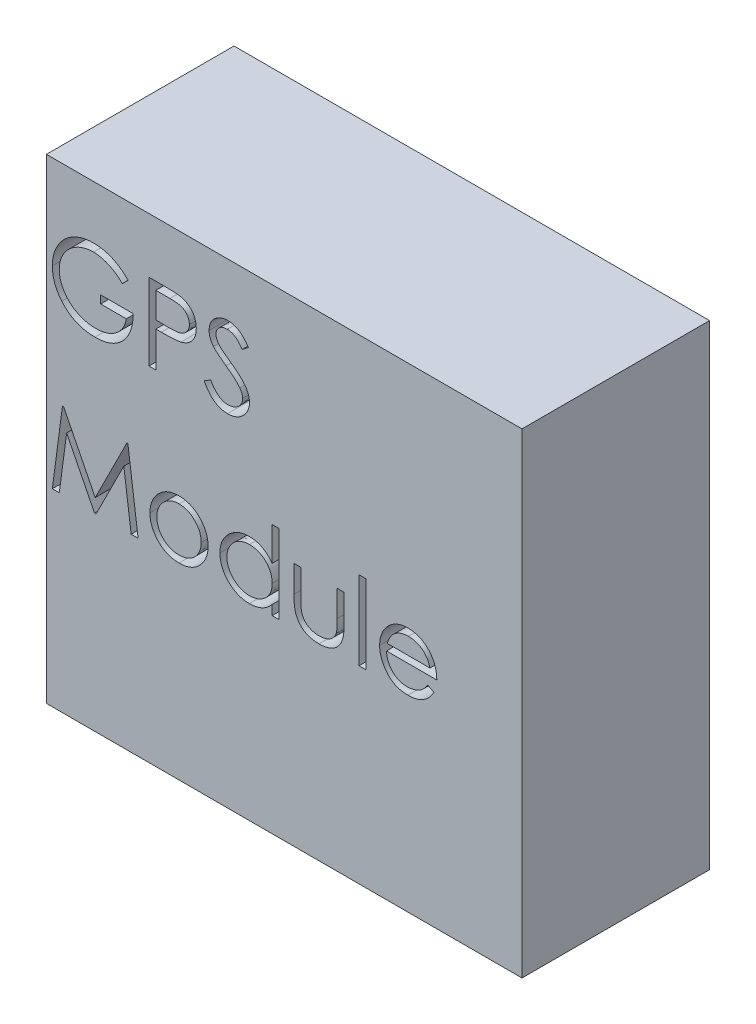
from build123d import *

# Parameters (mm, degrees)
SKETCH1_W           = 18
SKETCH1_H           = 18
BOSS_EXTRUDE1_DEPTH = 7.1
SKETCH2_W           = 0.261191239
SKETCH2_H           = 2.985042735
CUT_EXTRUDE1_DEPTH  = 2


with BuildPart() as part:
    # Sketch1 → Boss-Extrude1 (new body)
    with BuildSketch(Plane.XY):
        Rectangle(SKETCH1_W, SKETCH1_H)
    extrude(amount=BOSS_EXTRUDE1_DEPTH)

    # Sketch2 → Cut-Extrude1 (cut)
    # profile 1 of 9: a face of its own
    with BuildSketch(Plane.XY.offset(7.1)):
        with BuildLine():
            Line((-5.903018162, 6.413686899), (-6.126896368, 6.201469017))
            add(Edge.make_bspline(
                [(-6.126896368, 6.201469017), (-6.167408443, 6.239579562), (-6.24746656, 6.314891884), (-6.377986476, 6.412607873), (-6.514163736, 6.496316529), (-6.655287759, 6.564425464), (-6.797863711, 6.618769397), (-6.939999128, 6.657459761), (-7.08023606, 6.682133889), (-7.173508443, 6.685084527), (-7.21946865, 6.686538462)],
                knots=[0, 0, 0, 0, 1.08915593, 2.152340314, 3.188132944, 4.216796309, 5.218260357, 6.173443236, 7.099959455, 8, 8, 8, 8], degree=3))
            add(Edge.make_bspline(
                [(-7.21946865, 6.686538462), (-7.247670338, 6.686194529), (-7.304000571, 6.685507555), (-7.387672509, 6.676739537), (-7.470466909, 6.664129231), (-7.552227478, 6.645883515), (-7.633113184, 6.622758957), (-7.712842712, 6.593833188), (-7.791564788, 6.560109572), (-7.868537893, 6.521141193), (-7.943161395, 6.478333249), (-8.01364074, 6.430894671), (-8.080425155, 6.380345898), (-8.14225939, 6.325421363), (-8.199499125, 6.266618585), (-8.253506789, 6.205031419), (-8.30238291, 6.138977252), (-8.346530742, 6.069671396), (-8.385914183, 5.998331105), (-8.420680069, 5.925643041), (-8.449864969, 5.851848301), (-8.472956594, 5.776854282), (-8.492007893, 5.701241167), (-8.505410451, 5.624485396), (-8.512966493, 5.546504785), (-8.514273503, 5.494285875), (-8.514930556, 5.468034689)],
                knots=[0, 0, 0, 0, 1.02818874, 2.053710826, 3.065248034, 4.081641283, 5.106893873, 6.131558223, 7.173050175, 8.228653731, 9.27666206, 10.308777013, 11.325269123, 12.329503258, 13.32196095, 14.316845687, 15.314881793, 16.315733098, 17.311955233, 18.285320748, 19.252783886, 20.203351036, 21.145449891, 22.095197417, 23.042428769, 24, 24, 24, 24], degree=3))
            add(Edge.make_bspline(
                [(-8.514930556, 5.468034689), (-8.51430214, 5.441199968), (-8.513047024, 5.387603802), (-8.505014009, 5.30761385), (-8.490105823, 5.228811905), (-8.470175532, 5.150939023), (-8.445245056, 5.073861836), (-8.414167904, 4.997914505), (-8.37735895, 4.923099841), (-8.334753317, 4.850091941), (-8.288031813, 4.778975475), (-8.235691644, 4.711986397), (-8.180093885, 4.648232657), (-8.119213041, 4.589129775), (-8.055001314, 4.533096857), (-7.985540249, 4.481677676), (-7.912195703, 4.433881796), (-7.834855778, 4.390311595), (-7.754359654, 4.351388069), (-7.671822938, 4.316775817), (-7.58698195, 4.288270916), (-7.500282559, 4.265039052), (-7.411828118, 4.245996364), (-7.321169635, 4.233745605), (-7.228973698, 4.22485567), (-7.166824967, 4.224205674), (-7.135514323, 4.223878205)],
                knots=[0, 0, 0, 0, 0.93586088, 1.869166235, 2.799637598, 3.729985548, 4.670839027, 5.622275134, 6.589130586, 7.576015415, 8.568469353, 9.55398029, 10.53834874, 11.515998671, 12.510579167, 13.508179873, 14.527009472, 15.561807829, 16.601455013, 17.643573243, 18.680854198, 19.719860599, 20.772568776, 21.833555941, 22.908541556, 24, 24, 24, 24], degree=3))
            add(Edge.make_bspline(
                [(-7.135514323, 4.223878205), (-7.097780066, 4.224666992), (-7.023682723, 4.226215902), (-6.914761258, 4.238273583), (-6.810150014, 4.25710547), (-6.710142939, 4.284684493), (-6.614623879, 4.319862013), (-6.523242665, 4.362267105), (-6.436718756, 4.413526244), (-6.354792046, 4.471380228), (-6.279323124, 4.535837502), (-6.211257522, 4.605391849), (-6.151680886, 4.679705653), (-6.099705252, 4.758341215), (-6.056707044, 4.841949424), (-6.021413839, 4.930120549), (-5.994360858, 5.022894248), (-5.98325556, 5.086999611), (-5.977644231, 5.119391026)],
                knots=[0, 0, 0, 0, 1.13008108, 2.219097802, 3.278683437, 4.311054135, 5.322181354, 6.324827112, 7.324222904, 8.330512327, 9.32562643, 10.293043162, 11.24128371, 12.174520618, 13.111833804, 14.052305215, 15.015860969, 16, 16, 16, 16], degree=3))
            Line((-5.977644231, 5.119391026), (-6.94778312, 5.119391026))
            Line((-6.94778312, 5.119391026), (-6.94778312, 5.417895299))
            Line((-6.94778312, 5.417895299), (-5.716452991, 5.417895299))
            add(Edge.make_bspline(
                [(-5.716452991, 5.417895299), (-5.717871486, 5.362258536), (-5.720647735, 5.253367341), (-5.740121678, 5.094566467), (-5.771567909, 4.944578815), (-5.814525919, 4.803246427), (-5.870135899, 4.670769588), (-5.937801031, 4.547013794), (-6.018604277, 4.432778542), (-6.109667424, 4.327131245), (-6.211864591, 4.232892609), (-6.32243433, 4.150065528), (-6.441559321, 4.080296508), (-6.569126881, 4.023534517), (-6.704719397, 3.979234653), (-6.848650627, 3.947825789), (-7.000725386, 3.929007896), (-7.104948802, 3.926603577), (-7.158251953, 3.925373932)],
                knots=[0, 0, 0, 0, 1.140356446, 2.231883559, 3.274166699, 4.278491846, 5.25512956, 6.21435461, 7.1637429, 8.11826594, 9.068280886, 10.0076534, 10.945064095, 11.891975133, 12.864533718, 13.863980011, 14.907571808, 16, 16, 16, 16], degree=3))
            add(Edge.make_bspline(
                [(-7.158251953, 3.925373932), (-7.191106512, 3.925847183), (-7.255906291, 3.926780587), (-7.351609879, 3.933414132), (-7.444674709, 3.943626016), (-7.535087226, 3.959047169), (-7.623180003, 3.977935485), (-7.708513074, 4.002122477), (-7.791411505, 4.030119604), (-7.872003425, 4.06196428), (-7.949557337, 4.098861426), (-8.024418673, 4.139864739), (-8.097001243, 4.184762789), (-8.166810634, 4.234332046), (-8.23421058, 4.288201747), (-8.298766485, 4.346479863), (-8.36083975, 4.408988228), (-8.399723303, 4.453375417), (-8.419315905, 4.475741186)],
                knots=[0, 0, 0, 0, 1.107784379, 2.184907829, 3.233506516, 4.263428166, 5.276301166, 6.270063455, 7.25232949, 8.225834625, 9.190232166, 10.146266622, 11.1027726, 12.066435141, 13.031522626, 14.010570082, 14.99756817, 16, 16, 16, 16], degree=3))
            add(Edge.make_bspline(
                [(-8.419315905, 4.475741186), (-8.447743136, 4.511223866), (-8.504125734, 4.58160025), (-8.576701677, 4.694358061), (-8.638569986, 4.811108893), (-8.688768705, 4.93217776), (-8.727966269, 5.057451417), (-8.756077778, 5.186769787), (-8.772548482, 5.320299397), (-8.774921334, 5.410659739), (-8.776121795, 5.456374366)],
                knots=[0, 0, 0, 0, 1.023165419, 2.029347347, 3.013907458, 3.994755782, 4.975994455, 5.96558838, 6.970761222, 8, 8, 8, 8], degree=3))
            add(Edge.make_bspline(
                [(-8.776121795, 5.456374366), (-8.775679214, 5.490606065), (-8.774799676, 5.5586344), (-8.764134648, 5.659631935), (-8.748832993, 5.758836141), (-8.726342079, 5.856165926), (-8.697989411, 5.951686294), (-8.662604161, 6.045441594), (-8.621405221, 6.137487157), (-8.573520139, 6.227189415), (-8.520230859, 6.313358049), (-8.462396539, 6.395646174), (-8.399195926, 6.472555236), (-8.331661122, 6.545059244), (-8.258986362, 6.612247332), (-8.181852485, 6.674741554), (-8.100200044, 6.732625738), (-8.013772161, 6.784988155), (-7.923858843, 6.832023499), (-7.830675615, 6.873259289), (-7.734250924, 6.907338868), (-7.63530717, 6.936254922), (-7.533095415, 6.957638285), (-7.428357389, 6.973145605), (-7.320547147, 6.983756652), (-7.247673615, 6.984610032), (-7.210723407, 6.985042735)],
                knots=[0, 0, 0, 0, 1.008945113, 2.00506715, 2.99143336, 3.967273523, 4.948097931, 5.927297278, 6.919902385, 7.919676788, 8.923139349, 9.905703106, 10.883022732, 11.856032218, 12.825136022, 13.798837087, 14.781400844, 15.773989409, 16.776158564, 17.77167057, 18.775803737, 19.789618931, 20.80898985, 21.851988756, 22.910860228, 24, 24, 24, 24], degree=3))
            add(Edge.make_bspline(
                [(-7.210723407, 6.985042735), (-7.180589582, 6.98456086), (-7.120837748, 6.983605359), (-7.03192391, 6.976982374), (-6.944384385, 6.966485016), (-6.858089375, 6.952160123), (-6.773332748, 6.932648947), (-6.689873053, 6.909300516), (-6.607589307, 6.882115709), (-6.526739388, 6.849694627), (-6.446779668, 6.81289563), (-6.367265554, 6.771473397), (-6.288468729, 6.724719629), (-6.210252544, 6.672495498), (-6.132123774, 6.615697954), (-6.055318176, 6.552702547), (-5.977981799, 6.485993506), (-5.928253742, 6.438028023), (-5.903018162, 6.413686899)],
                knots=[0, 0, 0, 0, 0.985871117, 1.954866573, 2.915460327, 3.869826059, 4.81536089, 5.759505086, 6.70452669, 7.649098992, 8.607881297, 9.583363685, 10.581137262, 11.603961102, 12.659522466, 13.73993555, 14.853081303, 16, 16, 16, 16], degree=3))
        make_face()
    # profile 2 of 9: a face of its own
    with BuildSketch(Plane.XY.offset(7.1)):
        with BuildLine():
            Line((-5.119444444, 6.910416667), (-4.548671625, 6.910416667))
            add(Edge.make_bspline(
                [(-4.548671625, 6.910416667), (-4.509413508, 6.910373512), (-4.434193213, 6.910290827), (-4.326328967, 6.907783922), (-4.228364566, 6.904435536), (-4.140511243, 6.899793926), (-4.06249869, 6.894308547), (-3.994679912, 6.886615036), (-3.93652184, 6.87858204), (-3.901674632, 6.870415073), (-3.885782252, 6.866690455)],
                knots=[0, 0, 0, 0, 1.415646017, 2.712440637, 3.8905458, 4.950247383, 5.884950622, 6.709939814, 7.411656543, 8, 8, 8, 8], degree=3))
            add(Edge.make_bspline(
                [(-3.885782252, 6.866690455), (-3.865664176, 6.861183988), (-3.825902083, 6.850300808), (-3.768607584, 6.828502849), (-3.71409644, 6.802656548), (-3.662181626, 6.773199855), (-3.613501097, 6.738868943), (-3.567328549, 6.701055464), (-3.524071459, 6.65888638), (-3.483973075, 6.612834658), (-3.447148157, 6.563673388), (-3.41544151, 6.510668688), (-3.388892501, 6.454712765), (-3.366122006, 6.39584454), (-3.349733488, 6.333569669), (-3.337387584, 6.268320862), (-3.329551389, 6.20010511), (-3.328800866, 6.153488661), (-3.328418803, 6.12975803)],
                knots=[0, 0, 0, 0, 0.999701418, 1.975846123, 2.934577507, 3.890451536, 4.834027766, 5.787354733, 6.749476667, 7.726910423, 8.712836071, 9.690891519, 10.682875813, 11.679750201, 12.712814741, 13.765529915, 14.8625177, 16, 16, 16, 16], degree=3))
            add(Edge.make_bspline(
                [(-3.328418803, 6.12975803), (-3.328769238, 6.105827938), (-3.329454887, 6.059007097), (-3.33768412, 5.990510201), (-3.348768809, 5.925052111), (-3.365813084, 5.862777967), (-3.38813654, 5.804057591), (-3.414323681, 5.747993626), (-3.445908795, 5.695539875), (-3.48220155, 5.646505909), (-3.522574512, 5.600845702), (-3.566856866, 5.558890138), (-3.614869837, 5.520884804), (-3.666460838, 5.486744499), (-3.722132825, 5.457260915), (-3.781041449, 5.430853203), (-3.843698743, 5.408674946), (-3.887057726, 5.397008282), (-3.909102898, 5.391076556)],
                knots=[0, 0, 0, 0, 1.121902311, 2.195077645, 3.232258892, 4.234102512, 5.217864754, 6.176164875, 7.132989551, 8.084763148, 9.034132444, 9.988522005, 10.94243251, 11.903244335, 12.886203696, 13.894208494, 14.929344452, 16, 16, 16, 16], degree=3))
            add(Edge.make_bspline(
                [(-3.909102898, 5.391076556), (-3.92733652, 5.387199065), (-3.967296564, 5.378701318), (-4.033107506, 5.369214643), (-4.109730782, 5.361117365), (-4.197061809, 5.355046121), (-4.295022197, 5.349848642), (-4.403664939, 5.345717435), (-4.5232033, 5.343447432), (-4.606583614, 5.343330356), (-4.650116436, 5.343269231)],
                knots=[0, 0, 0, 0, 0.601384939, 1.31797006, 2.144135048, 3.087295005, 4.142315834, 5.309527816, 6.595305764, 8, 8, 8, 8], degree=3))
            Line((-4.650116436, 5.343269231), (-4.858253205, 5.343269231))
            Line((-4.858253205, 5.343269231), (-4.858253205, 4))
            Line((-4.858253205, 4), (-5.119444444, 4))
            Line((-5.119444444, 4), (-5.119444444, 6.910416667))
        make_face()
        with BuildLine():
            Line((-4.858253205, 6.611912393), (-4.858253205, 5.641773504))
            Line((-4.858253205, 5.641773504), (-4.348697082, 5.635360327))
            add(Edge.make_bspline(
                [(-4.348697082, 5.635360327), (-4.323817239, 5.635347468), (-4.275787215, 5.635322644), (-4.206406022, 5.638636547), (-4.142036513, 5.642462109), (-4.082876411, 5.648063351), (-4.028899047, 5.65598073), (-3.980014417, 5.663973347), (-3.936601575, 5.675536318), (-3.885794679, 5.691105442), (-3.829180134, 5.717658933), (-3.76758944, 5.756201073), (-3.715392709, 5.805329495), (-3.670224458, 5.8605674), (-3.634379868, 5.922018046), (-3.608139558, 5.987767632), (-3.592721703, 6.057141861), (-3.590654314, 6.104613367), (-3.589610043, 6.128591997)],
                knots=[0, 0, 0, 0, 1.160613943, 2.240541288, 3.23993089, 4.169200891, 5.011653406, 5.7853311, 6.478053781, 7.106038997, 8.262395093, 9.384106736, 10.481365981, 11.59014053, 12.70357646, 13.786202915, 14.881775077, 16, 16, 16, 16], degree=3))
            add(Edge.make_bspline(
                [(-3.589610043, 6.128591997), (-3.590659993, 6.151990511), (-3.592747165, 6.198503861), (-3.608260404, 6.266673104), (-3.634328851, 6.331729818), (-3.670465079, 6.392410413), (-3.71432184, 6.447449555), (-3.765295163, 6.495261154), (-3.823265059, 6.533696701), (-3.877189451, 6.558504496), (-3.925087581, 6.573651365), (-3.966691538, 6.584249306), (-4.013666224, 6.592710807), (-4.066026931, 6.599562346), (-4.123367822, 6.605427635), (-4.186181528, 6.609407403), (-4.254230099, 6.611736947), (-4.301470794, 6.611852495), (-4.325959452, 6.611912393)],
                knots=[0, 0, 0, 0, 1.120700087, 2.227813068, 3.331159281, 4.466773991, 5.599788987, 6.693661531, 7.80175334, 8.91857717, 9.525282508, 10.207424825, 10.974604443, 11.810962634, 12.737642355, 13.736264703, 14.826523623, 16, 16, 16, 16], degree=3))
            Line((-4.325959452, 6.611912393), (-4.858253205, 6.611912393))
        make_face(mode=Mode.SUBTRACT)
    # profile 3 of 9: a face of its own
    with BuildSketch(Plane.XY.offset(7.1)):
        with BuildLine():
            Line((-3.02991453, 4.561444561), (-2.783881711, 4.70894765))
            add(Edge.make_bspline(
                [(-2.783881711, 4.70894765), (-2.760998986, 4.67064292), (-2.717156569, 4.597252536), (-2.644020825, 4.498083797), (-2.56823947, 4.413796336), (-2.489251316, 4.344880491), (-2.407538501, 4.290622934), (-2.322567594, 4.252203579), (-2.234624938, 4.228241723), (-2.174775279, 4.225331234), (-2.144896, 4.223878205)],
                knots=[0, 0, 0, 0, 1.272034388, 2.437168799, 3.508375237, 4.49857839, 5.41946034, 6.295179144, 7.148887113, 8, 8, 8, 8], degree=3))
            add(Edge.make_bspline(
                [(-2.144896, 4.223878205), (-2.119378414, 4.224588906), (-2.068789741, 4.225997872), (-1.994314471, 4.239536134), (-1.92198496, 4.260334911), (-1.853291944, 4.290121721), (-1.78918327, 4.326159736), (-1.732965083, 4.369688075), (-1.684364357, 4.418421926), (-1.644608801, 4.472790716), (-1.614107605, 4.531262774), (-1.590664558, 4.591280514), (-1.577654934, 4.653786758), (-1.575695181, 4.695871768), (-1.574706197, 4.717109876)],
                knots=[0, 0, 0, 0, 1.095163259, 2.171163733, 3.241058638, 4.321873601, 5.38011039, 6.391990106, 7.366004449, 8.327778327, 9.272591725, 10.192022065, 11.087607919, 12, 12, 12, 12], degree=3))
            add(Edge.make_bspline(
                [(-1.574706197, 4.717109876), (-1.575932156, 4.74134188), (-1.578424353, 4.790602004), (-1.599488685, 4.863278977), (-1.632625231, 4.935201668), (-1.66319512, 4.979690518), (-1.679066089, 5.002787794)],
                knots=[0, 0, 0, 0, 0.938893495, 1.908633276, 2.914225137, 4, 4, 4, 4], degree=3))
            add(Edge.make_bspline(
                [(-1.679066089, 5.002787794), (-1.692096951, 5.019457682), (-1.719453616, 5.054454028), (-1.766483881, 5.106546524), (-1.821670465, 5.160279817), (-1.88312479, 5.217705711), (-1.95308546, 5.276153361), (-2.029361256, 5.338409899), (-2.113899596, 5.402107758), (-2.173188522, 5.444826493), (-2.203780632, 5.466868657)],
                knots=[0, 0, 0, 0, 0.722233717, 1.516239348, 2.393582979, 3.351407094, 4.387010283, 5.505090956, 6.712668013, 8, 8, 8, 8], degree=3))
            add(Edge.make_bspline(
                [(-2.203780632, 5.466868657), (-2.234401539, 5.488678976), (-2.29294638, 5.530378646), (-2.37481938, 5.592265982), (-2.448032543, 5.6488477), (-2.512260463, 5.700656453), (-2.56747489, 5.747699268), (-2.614110917, 5.789524399), (-2.650980539, 5.827262991), (-2.671482828, 5.851744869), (-2.680687851, 5.862736629)],
                knots=[0, 0, 0, 0, 1.452282411, 2.77665338, 3.964542531, 5.026858415, 5.96415736, 6.766646006, 7.446254459, 8, 8, 8, 8], degree=3))
            add(Edge.make_bspline(
                [(-2.680687851, 5.862736629), (-2.693554009, 5.879867372), (-2.718857035, 5.913557277), (-2.752256982, 5.966214912), (-2.780645321, 6.020118544), (-2.802899475, 6.075413022), (-2.821639414, 6.131322067), (-2.834243955, 6.188575156), (-2.842136504, 6.246915388), (-2.842944757, 6.286175662), (-2.843349359, 6.30582891)],
                knots=[0, 0, 0, 0, 1.068054152, 2.10047183, 3.106115577, 4.101338837, 5.06977816, 6.043150881, 7.020423561, 8, 8, 8, 8], degree=3))
            add(Edge.make_bspline(
                [(-2.843349359, 6.30582891), (-2.842264016, 6.33662093), (-2.840116527, 6.397546814), (-2.821955097, 6.486548047), (-2.793289244, 6.571520919), (-2.753129745, 6.651624178), (-2.701359792, 6.72477208), (-2.641450133, 6.791806033), (-2.570093796, 6.848158837), (-2.491801407, 6.897396483), (-2.406105126, 6.935935326), (-2.316305547, 6.965007046), (-2.222259946, 6.981479387), (-2.158560792, 6.983843282), (-2.126239483, 6.985042735)],
                knots=[0, 0, 0, 0, 1.005424448, 1.989358655, 2.955360095, 3.929531133, 4.905563448, 5.876582895, 6.856512386, 7.866279853, 8.892233794, 9.918561126, 10.94386622, 12, 12, 12, 12], degree=3))
            add(Edge.make_bspline(
                [(-2.126239483, 6.985042735), (-2.09194305, 6.983859816), (-2.02373839, 6.981507367), (-1.923412822, 6.961053348), (-1.826819655, 6.927208801), (-1.749117131, 6.888800733), (-1.688303757, 6.850440264), (-1.641926074, 6.815498779), (-1.594929122, 6.775272573), (-1.546933811, 6.729654497), (-1.498753394, 6.678225978), (-1.449672583, 6.621339233), (-1.399576604, 6.559341906), (-1.367349261, 6.5150832), (-1.350827991, 6.492394081)],
                knots=[0, 0, 0, 0, 1.286793592, 2.559021753, 3.825965368, 5.121522368, 5.803751409, 6.523245864, 7.299691795, 8.125521123, 9.008227632, 9.944561021, 10.946284179, 12, 12, 12, 12], degree=3))
            Line((-1.350827991, 6.492394081), (-1.586949536, 6.31340812))
            add(Edge.make_bspline(
                [(-1.586949536, 6.31340812), (-1.601207195, 6.331775918), (-1.628664114, 6.367148002), (-1.670349169, 6.416684388), (-1.70963867, 6.461934281), (-1.748347544, 6.501237486), (-1.784431415, 6.536746343), (-1.819453741, 6.567147522), (-1.85291052, 6.592738895), (-1.895084046, 6.620049879), (-1.948068363, 6.647122162), (-2.014579314, 6.670030533), (-2.084085282, 6.683796855), (-2.131424981, 6.685617019), (-2.155390291, 6.686538462)],
                knots=[0, 0, 0, 0, 1.181633172, 2.275549214, 3.290209073, 4.226197932, 5.078386478, 5.862611352, 6.581680152, 7.217281963, 8.414376989, 9.595101626, 10.782541182, 12, 12, 12, 12], degree=3))
            add(Edge.make_bspline(
                [(-2.155390291, 6.686538462), (-2.185456161, 6.685530875), (-2.243435359, 6.68358784), (-2.325750455, 6.662366757), (-2.399836296, 6.628953627), (-2.463493399, 6.582125041), (-2.516493731, 6.526643358), (-2.554832615, 6.462798084), (-2.577908198, 6.392297479), (-2.580724051, 6.343118376), (-2.58215812, 6.318072249)],
                knots=[0, 0, 0, 0, 1.14458467, 2.207223713, 3.21896685, 4.227309161, 5.202851033, 6.127160689, 7.046193047, 8, 8, 8, 8], degree=3))
            add(Edge.make_bspline(
                [(-2.58215812, 6.318072249), (-2.581831216, 6.302479502), (-2.581176875, 6.27126851), (-2.572050808, 6.225158012), (-2.560326544, 6.179163999), (-2.541747582, 6.133493256), (-2.516098243, 6.087347054), (-2.482416261, 6.039930764), (-2.439996262, 5.990826456), (-2.407501866, 5.958888896), (-2.390345803, 5.942026826)],
                knots=[0, 0, 0, 0, 0.858281714, 1.717966888, 2.583508476, 3.4729293, 4.427298488, 5.488583878, 6.674047936, 8, 8, 8, 8], degree=3))
            add(Edge.make_bspline(
                [(-2.390345803, 5.942026826), (-2.383975007, 5.936341514), (-2.368839454, 5.922834513), (-2.341168938, 5.900721765), (-2.304628408, 5.873444698), (-2.260172042, 5.839694411), (-2.206980135, 5.800543934), (-2.145046837, 5.756493852), (-2.075062515, 5.706114158), (-2.025400898, 5.670891846), (-1.99914196, 5.652267795)],
                knots=[0, 0, 0, 0, 0.420754252, 0.999615792, 1.744751191, 2.668019286, 3.750313428, 4.999500688, 6.413464383, 8, 8, 8, 8], degree=3))
            add(Edge.make_bspline(
                [(-1.99914196, 5.652267795), (-1.967554865, 5.629282688), (-1.906390832, 5.584775215), (-1.81936307, 5.517905748), (-1.74045435, 5.452506383), (-1.669387627, 5.388994766), (-1.605460816, 5.327852655), (-1.54938314, 5.268344463), (-1.500583203, 5.210896519), (-1.448046674, 5.137244205), (-1.394363773, 5.046787553), (-1.348261519, 4.935960351), (-1.319191989, 4.82470234), (-1.315390556, 4.749923893), (-1.313514957, 4.713028763)],
                knots=[0, 0, 0, 0, 1.163667725, 2.253281268, 3.268753668, 4.215851969, 5.092017293, 5.902905408, 6.650798638, 7.335211899, 8.59617414, 9.77448103, 10.901945474, 12, 12, 12, 12], degree=3))
            add(Edge.make_bspline(
                [(-1.313514957, 4.713028763), (-1.314061399, 4.686936158), (-1.315143671, 4.635257649), (-1.327584383, 4.559374707), (-1.345811628, 4.485673919), (-1.373283662, 4.415066285), (-1.406814288, 4.346260075), (-1.449361459, 4.281060172), (-1.498678623, 4.218023542), (-1.555251939, 4.158831079), (-1.617157251, 4.104492605), (-1.68258649, 4.056155522), (-1.751646747, 4.015851804), (-1.823963381, 3.982963395), (-1.899553002, 3.957240702), (-1.978390189, 3.938603334), (-2.060604896, 3.927164806), (-2.116485296, 3.925977554), (-2.144896, 3.925373932)],
                knots=[0, 0, 0, 0, 0.983748083, 1.948392443, 2.894712957, 3.844097841, 4.80183111, 5.778335162, 6.776009319, 7.81870978, 8.863265674, 9.881300176, 10.883814829, 11.87499822, 12.874611388, 13.892143829, 14.928324115, 16, 16, 16, 16], degree=3))
            add(Edge.make_bspline(
                [(-2.144896, 3.925373932), (-2.166878247, 3.925799003), (-2.210565896, 3.926643794), (-2.275185031, 3.934112156), (-2.338498725, 3.944678718), (-2.399712506, 3.961454418), (-2.459615044, 3.98180819), (-2.51794581, 4.006869648), (-2.574733073, 4.036902821), (-2.630295075, 4.071241601), (-2.684490505, 4.111203904), (-2.736811038, 4.157748531), (-2.788973343, 4.209591788), (-2.839437803, 4.268141524), (-2.889225174, 4.332451823), (-2.937353827, 4.403124376), (-2.984819994, 4.479774235), (-3.014602261, 4.533712642), (-3.02991453, 4.561444561)],
                knots=[0, 0, 0, 0, 0.915332311, 1.819136955, 2.706846663, 3.586547465, 4.459518054, 5.340707479, 6.227863349, 7.133153174, 8.059268498, 9.028702269, 10.047606654, 11.120612155, 12.245963614, 13.433783089, 14.680604001, 16, 16, 16, 16], degree=3))
        make_face()
    # profile 4 of 9: a face of its own
    with BuildSketch(Plane.XY.offset(7.1)):
        Polygon((-8.776121795, -1.850694444), (-8.391914146, 1.059722222), (-8.354601112, 1.059722222), (-7.153004808, -1.328311966), (-5.954323584, 1.059722222), (-5.916427534, 1.059722222), (-5.529887821, -1.850694444), (-5.792245092, -1.850694444), (-6.070926816, 0.243499599), (-7.121521935, -1.850694444), (-7.180406567, -1.850694444), (-8.235082799, 0.248163729), (-8.513181507, -1.850694444), align=None)
    # profile 5 of 9: a face of its own
    with BuildSketch(Plane.XY.offset(7.1)):
        with BuildLine():
            add(Edge.make_bspline(
                [(-3.980230869, 0.313461538), (-3.940323841, 0.312611787), (-3.86207591, 0.310945633), (-3.747482091, 0.293138069), (-3.638096046, 0.265907076), (-3.533498838, 0.228261617), (-3.435030049, 0.177801685), (-3.34125539, 0.117589912), (-3.25243196, 0.0462576), (-3.199193763, -0.008922294), (-3.172170473, -0.036931173)],
                knots=[0, 0, 0, 0, 1.054011418, 2.066658804, 3.057071809, 4.030435133, 4.997543892, 5.974964718, 6.972108034, 8, 8, 8, 8], degree=3))
            add(Edge.make_bspline(
                [(-3.172170473, -0.036931173), (-3.148902145, -0.063718636), (-3.102815797, -0.116775152), (-3.043721268, -0.20280342), (-2.992812625, -0.291895516), (-2.952014437, -0.385234513), (-2.919845998, -0.482005594), (-2.897006963, -0.582541373), (-2.883422024, -0.686619825), (-2.881590152, -0.757304564), (-2.880662393, -0.793103132)],
                knots=[0, 0, 0, 0, 1.025258237, 2.030674902, 3.01204498, 3.988269485, 4.97094183, 5.956517959, 6.965070386, 8, 8, 8, 8], degree=3))
            add(Edge.make_bspline(
                [(-2.880662393, -0.793103132), (-2.881478422, -0.829109192), (-2.883090933, -0.900258845), (-2.898344523, -1.005049949), (-2.92206948, -1.106660762), (-2.956023098, -1.204665879), (-2.999561359, -1.299364873), (-3.052689508, -1.390344123), (-3.11578037, -1.477783129), (-3.187296789, -1.560939419), (-3.26633695, -1.637580016), (-3.352082938, -1.704376797), (-3.442849715, -1.761605172), (-3.539844218, -1.807703191), (-3.642180693, -1.844049889), (-3.750079874, -1.869578414), (-3.863374138, -1.885013338), (-3.940730703, -1.886995393), (-3.980230869, -1.888007479)],
                knots=[0, 0, 0, 0, 0.998656419, 1.973391657, 2.932242238, 3.890759089, 4.846373663, 5.82037756, 6.809684879, 7.83454468, 8.860553229, 9.859544525, 10.845671541, 11.83227036, 12.833544569, 13.85385346, 14.904124723, 16, 16, 16, 16], degree=3))
            add(Edge.make_bspline(
                [(-3.980230869, -1.888007479), (-4.019924562, -1.886991996), (-4.097666664, -1.885003121), (-4.211360828, -1.869638381), (-4.319453386, -1.844061654), (-4.421923834, -1.807583745), (-4.519335353, -1.761603698), (-4.610628053, -1.704549811), (-4.696443697, -1.637560206), (-4.775500579, -1.560944787), (-4.847012515, -1.477781746), (-4.910104534, -1.390344482), (-4.963232383, -1.299364779), (-5.006770722, -1.204665904), (-5.040724319, -1.106660756), (-5.064449281, -1.00504995), (-5.07970287, -0.900258845), (-5.081315381, -0.829109191), (-5.08213141, -0.793103132)],
                knots=[0, 0, 0, 0, 1.099876186, 2.154163076, 3.173186993, 4.173200201, 5.163417411, 6.152872554, 7.150605724, 8.17532212, 9.198891216, 10.186952605, 11.159729845, 12.11414092, 13.071450619, 14.029093627, 15.002601286, 16, 16, 16, 16], degree=3))
            add(Edge.make_bspline(
                [(-5.08213141, -0.793103132), (-5.081197324, -0.757499135), (-5.079347994, -0.68700934), (-5.065776714, -0.58312654), (-5.043026771, -0.482760914), (-5.010819771, -0.38636336), (-4.969645532, -0.293433394), (-4.919452247, -0.204121162), (-4.859754917, -0.118481902), (-4.813851866, -0.065493958), (-4.790623331, -0.038680222)],
                knots=[0, 0, 0, 0, 1.031353054, 2.041901799, 3.029428768, 4.008703097, 4.981709435, 5.96992636, 6.972712378, 8, 8, 8, 8], degree=3))
            add(Edge.make_bspline(
                [(-4.790623331, -0.038680222), (-4.763640782, -0.010428442), (-4.710574852, 0.045133654), (-4.621309273, 0.116258021), (-4.527765304, 0.177722756), (-4.428208327, 0.227180062), (-4.323697046, 0.26612852), (-4.213750449, 0.293208296), (-4.098767774, 0.310881473), (-4.020136946, 0.312592946), (-3.980230869, 0.313461538)],
                knots=[0, 0, 0, 0, 1.027980169, 2.021703884, 2.998553061, 3.971491411, 4.943284454, 5.930300938, 6.949603206, 8, 8, 8, 8], degree=3))
        make_face()
        with BuildLine():
            add(Edge.make_bspline(
                [(-3.981396902, 0.052270299), (-4.009617642, 0.051468195), (-4.065330608, 0.049884694), (-4.147337488, 0.037840637), (-4.226284747, 0.018758695), (-4.302322164, -0.008353131), (-4.375193319, -0.04336037), (-4.444967983, -0.086358334), (-4.511851387, -0.136777524), (-4.574535162, -0.194539043), (-4.632063549, -0.257636041), (-4.682353867, -0.324865301), (-4.725116292, -0.395136352), (-4.760739924, -0.468522268), (-4.78727227, -0.545766734), (-4.806541742, -0.625994973), (-4.818574436, -0.709370441), (-4.820143049, -0.766049574), (-4.820940171, -0.79485218)],
                knots=[0, 0, 0, 0, 1.021534396, 2.016698045, 2.994645724, 3.958388632, 4.93408049, 5.916473867, 6.921342795, 7.962252576, 8.998418191, 10.008913653, 10.997312074, 11.973003931, 12.956656626, 13.948281152, 14.957379055, 16, 16, 16, 16], degree=3))
            add(Edge.make_bspline(
                [(-4.820940171, -0.79485218), (-4.819604021, -0.832065622), (-4.816952012, -0.905927345), (-4.795385628, -1.014703022), (-4.75930787, -1.119130312), (-4.710589757, -1.218597033), (-4.649548991, -1.310626303), (-4.577630876, -1.392676341), (-4.495607268, -1.463512399), (-4.404455929, -1.522286888), (-4.306038677, -1.568986399), (-4.201882082, -1.602081143), (-4.093248124, -1.623594687), (-4.019006944, -1.62573299), (-3.981396902, -1.626816239)],
                knots=[0, 0, 0, 0, 1.016792936, 2.018143844, 3.017858371, 4.030088057, 5.03801393, 6.028138512, 7.003788237, 7.991172063, 8.984598303, 9.972568034, 10.972917682, 12, 12, 12, 12], degree=3))
            add(Edge.make_bspline(
                [(-3.981396902, -1.626816239), (-3.943789022, -1.625726679), (-3.869552113, -1.623575917), (-3.761069095, -1.602189494), (-3.657197179, -1.56884139), (-3.55888215, -1.522339409), (-3.467772302, -1.463289205), (-3.385158777, -1.393076337), (-3.313854724, -1.310408985), (-3.252874339, -1.218475135), (-3.203358387, -1.119284517), (-3.167449498, -1.014683749), (-3.145831268, -0.905932253), (-3.143186257, -0.832067266), (-3.141853632, -0.79485218)],
                knots=[0, 0, 0, 0, 1.02726834, 2.027799167, 3.010890988, 4.004497153, 4.992059811, 5.971914811, 6.958719428, 7.966827853, 8.981595046, 9.981490638, 10.983022906, 12, 12, 12, 12], degree=3))
            add(Edge.make_bspline(
                [(-3.141853632, -0.79485218), (-3.14265048, -0.766049402), (-3.144218553, -0.70936993), (-3.156255175, -0.625996926), (-3.175510109, -0.545759568), (-3.202096031, -0.468548706), (-3.237564875, -0.394946344), (-3.281151935, -0.325071624), (-3.3312369, -0.257403151), (-3.389459471, -0.194743011), (-3.452077815, -0.136755007), (-3.518988326, -0.086338783), (-3.588659525, -0.043549342), (-3.661318978, -0.0080537), (-3.737366143, 0.018512035), (-3.816202785, 0.037950817), (-3.897859772, 0.049833796), (-3.953373095, 0.051452937), (-3.981396902, 0.052270299)],
                knots=[0, 0, 0, 0, 1.042956736, 2.052379634, 3.044323526, 4.02829302, 5.004299113, 5.996692471, 7.007513377, 8.048758398, 9.090003419, 10.095195979, 11.07790575, 12.047570684, 13.018257071, 13.989683339, 14.985167495, 16, 16, 16, 16], degree=3))
        make_face(mode=Mode.SUBTRACT)
    # profile 6 of 9: a face of its own
    with BuildSketch(Plane.XY.offset(7.1)):
        with BuildLine():
            Line((-0.194123932, 1.134348291), (-0.194123932, -1.850694444))
            Line((-0.194123932, -1.850694444), (-0.455315171, -1.850694444))
            Line((-0.455315171, -1.850694444), (-0.455315171, -1.482811248))
            add(Edge.make_bspline(
                [(-0.455315171, -1.482811248), (-0.484767582, -1.516106077), (-0.542244332, -1.581081355), (-0.638239119, -1.665967542), (-0.739994086, -1.736132134), (-0.847015363, -1.792802035), (-0.959206307, -1.835370667), (-1.07631822, -1.865627491), (-1.198398875, -1.885080579), (-1.281763482, -1.887023092), (-1.324009248, -1.888007479)],
                knots=[0, 0, 0, 0, 1.074387032, 2.096679803, 3.090159297, 4.057316773, 5.018401886, 5.985159533, 6.978961417, 8, 8, 8, 8], degree=3))
            add(Edge.make_bspline(
                [(-1.324009248, -1.888007479), (-1.361568553, -1.886987692), (-1.435637164, -1.884976627), (-1.544594081, -1.869374878), (-1.649445791, -1.844319831), (-1.750291373, -1.809477246), (-1.84647827, -1.763259146), (-1.938830029, -1.70792693), (-2.026868214, -1.642034406), (-2.109250917, -1.566706147), (-2.185114669, -1.48488603), (-2.25168943, -1.39761881), (-2.307197794, -1.305281847), (-2.35361485, -1.209044218), (-2.389368358, -1.108165086), (-2.414292862, -1.002993298), (-2.429876436, -0.893653207), (-2.431886669, -0.819196829), (-2.432905983, -0.781442808)],
                knots=[0, 0, 0, 0, 1.033919861, 2.038935746, 3.024066025, 3.998881131, 4.97069526, 5.957263378, 6.95902576, 7.993208707, 9.027059324, 10.027763471, 11.009749337, 11.988697705, 12.965288445, 13.950418724, 14.960734635, 16, 16, 16, 16], degree=3))
            add(Edge.make_bspline(
                [(-2.432905983, -0.781442808), (-2.431864078, -0.744469122), (-2.429804287, -0.671374137), (-2.414459556, -0.563872744), (-2.388655794, -0.460329881), (-2.352443685, -0.361078899), (-2.306008441, -0.265999702), (-2.249523002, -0.175025046), (-2.182983289, -0.087904303), (-2.10627102, -0.006686027), (-2.023170499, 0.06833671), (-1.934270799, 0.133537565), (-1.841783344, 0.18984735), (-1.744273567, 0.23446277), (-1.64318473, 0.270559508), (-1.537616895, 0.295533351), (-1.42800929, 0.310249516), (-1.353593685, 0.312380577), (-1.315847022, 0.313461538)],
                knots=[0, 0, 0, 0, 1.020392517, 2.01726096, 2.990465484, 3.961182959, 4.928053699, 5.906110375, 6.912531644, 7.948652711, 8.985773172, 9.998621852, 10.987621588, 11.969261332, 12.953316658, 13.946091881, 14.958173133, 16, 16, 16, 16], degree=3))
            add(Edge.make_bspline(
                [(-1.315847022, 0.313461538), (-1.27242626, 0.312158423), (-1.187196129, 0.309600554), (-1.06254837, 0.288224485), (-0.94464522, 0.252332497), (-0.832807897, 0.203195283), (-0.727703138, 0.139331801), (-0.628560509, 0.062204555), (-0.537104139, -0.030369268), (-0.48299382, -0.099896273), (-0.455315171, -0.135460904)],
                knots=[0, 0, 0, 0, 1.031072012, 2.023879775, 2.993683497, 3.952812103, 4.918022106, 5.908088563, 6.929940113, 8, 8, 8, 8], degree=3))
            Line((-0.455315171, -0.135460904), (-0.455315171, 1.134348291))
            Line((-0.455315171, 1.134348291), (-0.194123932, 1.134348291))
        make_face()
        with BuildLine():
            add(Edge.make_bspline(
                [(-1.312348925, 0.052270299), (-1.350528883, 0.050911852), (-1.425890048, 0.048230492), (-1.536522471, 0.027297532), (-1.642389638, -0.007531503), (-1.742962058, -0.055164131), (-1.836651045, -0.115059456), (-1.920382627, -0.187505034), (-1.994841647, -0.270524266), (-2.057464055, -0.363742509), (-2.108513177, -0.463676314), (-2.144408619, -0.568139017), (-2.168082154, -0.675246489), (-2.170500728, -0.747892722), (-2.171714744, -0.784357889)],
                knots=[0, 0, 0, 0, 1.031046209, 2.035121221, 3.029706178, 4.034933723, 5.034054252, 6.02443088, 7.017295772, 8.038157696, 9.050218397, 10.03989886, 11.016116709, 12, 12, 12, 12], degree=3))
            add(Edge.make_bspline(
                [(-2.171714744, -0.784357889), (-2.170163996, -0.820605139), (-2.167068579, -0.892957562), (-2.144824103, -1.000211053), (-2.107504351, -1.104698373), (-2.05657866, -1.205532663), (-1.992810079, -1.299151704), (-1.918894932, -1.383753461), (-1.834118418, -1.456505219), (-1.740213819, -1.517405749), (-1.639922548, -1.566602203), (-1.534454094, -1.600833392), (-1.425791079, -1.622934082), (-1.351906132, -1.625515603), (-1.31468099, -1.626816239)],
                knots=[0, 0, 0, 0, 0.979072187, 1.954306742, 2.945804271, 3.96968567, 4.997920485, 5.998718438, 6.996577872, 8.005894225, 9.015743152, 10.005417472, 10.995077863, 12, 12, 12, 12], degree=3))
            add(Edge.make_bspline(
                [(-1.31468099, -1.626816239), (-1.276890058, -1.6254359), (-1.201727645, -1.622690543), (-1.090767005, -1.601667967), (-0.983085777, -1.566935222), (-0.880150802, -1.518789341), (-0.784259947, -1.459119683), (-0.698196534, -1.389263786), (-0.625422839, -1.308018936), (-0.563728151, -1.218730302), (-0.515352521, -1.120847172), (-0.48011481, -1.016625824), (-0.459281295, -0.90606263), (-0.456655492, -0.830504948), (-0.455315171, -0.791937099)],
                knots=[0, 0, 0, 0, 1.01762866, 2.023962475, 3.030623092, 4.058876274, 5.077231937, 6.066672613, 7.034107872, 8.005628644, 8.981990164, 9.965428785, 10.961468474, 12, 12, 12, 12], degree=3))
            add(Edge.make_bspline(
                [(-0.455315171, -0.791937099), (-0.456113171, -0.762552011), (-0.457683887, -0.704712857), (-0.469683593, -0.619788963), (-0.488771708, -0.538518715), (-0.515669088, -0.46081667), (-0.551002615, -0.387112434), (-0.593617572, -0.316876795), (-0.644263354, -0.250475047), (-0.702124679, -0.188821553), (-0.765459672, -0.132586929), (-0.83247787, -0.082391189), (-0.903973293, -0.041155763), (-0.978743591, -0.007027991), (-1.056918492, 0.020129647), (-1.139134121, 0.038247152), (-1.224516588, 0.050687371), (-1.282763218, 0.051737101), (-1.312348925, 0.052270299)],
                knots=[0, 0, 0, 0, 1.050140795, 2.067009409, 3.05949893, 4.030605086, 5.00011959, 5.97591094, 6.962425594, 7.979863591, 8.993523472, 9.986985069, 10.967611495, 11.937549037, 12.921786183, 13.919465291, 14.943216303, 16, 16, 16, 16], degree=3))
        make_face(mode=Mode.SUBTRACT)
    # profile 7 of 9: a face of its own
    with BuildSketch(Plane.XY.offset(7.1)):
        with BuildLine():
            Line((0.365571581, 0.276148504), (0.626762821, 0.276148504))
            Line((0.626762821, 0.276148504), (0.626762821, -0.710314837))
            add(Edge.make_bspline(
                [(0.626762821, -0.710314837), (0.626880821, -0.739271611), (0.627106551, -0.794664564), (0.628637381, -0.874372716), (0.63223806, -0.947063875), (0.636739913, -1.012780033), (0.642529261, -1.071510073), (0.649417269, -1.123048859), (0.657116088, -1.167980857), (0.664652166, -1.195042206), (0.668156968, -1.207627621)],
                knots=[0, 0, 0, 0, 1.388932606, 2.656963016, 3.823490214, 4.879454478, 5.816252168, 6.653371382, 7.373723809, 8, 8, 8, 8], degree=3))
            add(Edge.make_bspline(
                [(0.668156968, -1.207627621), (0.67377944, -1.223446044), (0.684907493, -1.254754029), (0.705092051, -1.299981077), (0.730062043, -1.341870523), (0.757386554, -1.382037659), (0.788901717, -1.419292645), (0.824208789, -1.453572567), (0.862125894, -1.486172635), (0.918467423, -1.524743799), (0.995518015, -1.566084463), (1.096678074, -1.601754379), (1.206362719, -1.623071784), (1.282170524, -1.625545019), (1.321135066, -1.626816239)],
                knots=[0, 0, 0, 0, 0.725840625, 1.436591201, 2.137033971, 2.831655856, 3.53531722, 4.242432219, 4.957935707, 5.694543706, 7.190802206, 8.724350549, 10.316345118, 12, 12, 12, 12], degree=3))
            add(Edge.make_bspline(
                [(1.321135066, -1.626816239), (1.360095989, -1.625517987), (1.435478166, -1.623006108), (1.543957685, -1.602397416), (1.643120915, -1.567966614), (1.731972569, -1.519896998), (1.810109639, -1.461071604), (1.875223492, -1.392045827), (1.928947501, -1.31500345), (1.952404978, -1.25752332), (1.96420189, -1.228616203)],
                knots=[0, 0, 0, 0, 1.157059328, 2.238695713, 3.266970494, 4.264342957, 5.228770407, 6.160125903, 7.074715775, 8, 8, 8, 8], degree=3))
            add(Edge.make_bspline(
                [(1.96420189, -1.228616203), (1.967689592, -1.21700256), (1.975400049, -1.191327633), (1.983684219, -1.147771378), (1.991146911, -1.095829085), (1.997519207, -1.03516086), (2.00206375, -0.965925247), (2.004513511, -0.888143883), (2.007281131, -0.802060942), (2.007323137, -0.741800549), (2.007345085, -0.710314837)],
                knots=[0, 0, 0, 0, 0.557542046, 1.232589297, 2.036731608, 2.971723315, 4.038036528, 5.22795436, 6.551621927, 8, 8, 8, 8], degree=3))
            Line((2.007345085, -0.710314837), (2.007345085, 0.276148504))
            Line((2.007345085, 0.276148504), (2.268536325, 0.276148504))
            Line((2.268536325, 0.276148504), (2.268536325, -0.759288194))
            add(Edge.make_bspline(
                [(2.268536325, -0.759288194), (2.268169035, -0.794468622), (2.267456441, -0.862723464), (2.262876823, -0.961913883), (2.25501902, -1.054350583), (2.243092394, -1.140082494), (2.229067783, -1.219044162), (2.210976406, -1.291336788), (2.189374264, -1.356737637), (2.165005333, -1.416394341), (2.136215601, -1.470483931), (2.10559218, -1.521820202), (2.070230807, -1.569129387), (2.033002226, -1.614766498), (1.991589777, -1.656461565), (1.946769478, -1.695171334), (1.899172175, -1.73148754), (1.847741621, -1.7639938), (1.793228633, -1.793278118), (1.735565914, -1.819235773), (1.674047191, -1.839777142), (1.609466179, -1.857497976), (1.54150647, -1.871396853), (1.470233581, -1.881197944), (1.39567152, -1.887206151), (1.344856094, -1.887735884), (1.318803001, -1.888007479)],
                knots=[0, 0, 0, 0, 1.493040784, 2.896703357, 4.213163133, 5.428574705, 6.569057535, 7.615249723, 8.588095153, 9.490268104, 10.346124644, 11.18633936, 12.024365274, 12.850166724, 13.684164916, 14.514361689, 15.362232829, 16.222528818, 17.093394965, 17.986930858, 18.902426812, 19.842810585, 20.827885679, 21.843828298, 22.894529745, 24, 24, 24, 24], degree=3))
            add(Edge.make_bspline(
                [(1.318803001, -1.888007479), (1.292944769, -1.887724996), (1.242130936, -1.887169891), (1.167565026, -1.881231138), (1.096094667, -1.871412082), (1.027973955, -1.857396166), (0.96313453, -1.839901177), (0.901313755, -1.819109547), (0.843235506, -1.793264646), (0.788202018, -1.764179142), (0.73664408, -1.731278731), (0.68832403, -1.695216141), (0.643306659, -1.656045207), (0.601582038, -1.613929517), (0.563735831, -1.568346624), (0.52929642, -1.519663203), (0.497733612, -1.468361631), (0.469167631, -1.413426965), (0.444627201, -1.353079883), (0.422961023, -1.286309023), (0.405240213, -1.212382347), (0.390819124, -1.131363059), (0.379217837, -1.043638908), (0.371163349, -0.948702435), (0.366659827, -0.846784888), (0.365942151, -0.776394474), (0.365571581, -0.740048661)],
                knots=[0, 0, 0, 0, 1.083640291, 2.129454052, 3.13281866, 4.105697902, 5.042300162, 5.946461698, 6.836384745, 7.703652036, 8.553297018, 9.397182691, 10.228592656, 11.052265423, 11.879314572, 12.708807002, 13.549817954, 14.402308542, 15.300838682, 16.27712199, 17.341985831, 18.484375296, 19.725102775, 21.0496083, 22.476576903, 24, 24, 24, 24], degree=3))
            Line((0.365571581, -0.740048661), (0.365571581, 0.276148504))
        make_face()
    # profile 8 of 9: a face of its own
    with BuildSketch(Plane.XY.offset(7.1)):
        with Locations((2.958827457, -0.358173077)):
            Rectangle(SKETCH2_W, SKETCH2_H)
    # profile 9 of 9: a face of its own
    with BuildSketch(Plane.XY.offset(7.1)):
        with BuildLine():
            Line((5.431982005, -1.179059829), (5.664022436, -1.300910206))
            add(Edge.make_bspline(
                [(5.664022436, -1.300910206), (5.645531648, -1.333709215), (5.609555897, -1.397523096), (5.547688133, -1.485194708), (5.48283401, -1.564065101), (5.412066008, -1.6320272), (5.3375014, -1.69127612), (5.258726687, -1.743112989), (5.175331759, -1.787283568), (5.087312673, -1.824497426), (4.993930248, -1.853110559), (4.89495819, -1.873320676), (4.790206893, -1.88581324), (4.718405932, -1.887264407), (4.681640208, -1.888007479)],
                knots=[0, 0, 0, 0, 1.120438281, 2.179929193, 3.190490725, 4.156257408, 5.095198341, 6.022838206, 6.959905092, 7.901321166, 8.864066838, 9.862729781, 10.905609505, 12, 12, 12, 12], degree=3))
            add(Edge.make_bspline(
                [(4.681640208, -1.888007479), (4.640776313, -1.887053548), (4.561062694, -1.885192705), (4.445028749, -1.869150102), (4.335780507, -1.842979337), (4.233324108, -1.806419896), (4.137910461, -1.758666341), (4.049349929, -1.700491701), (3.967176787, -1.63219482), (3.893980466, -1.553184122), (3.828085404, -1.468630733), (3.769938755, -1.380523369), (3.721328617, -1.289083712), (3.681786357, -1.194893877), (3.649850883, -1.098547533), (3.627593094, -0.999168056), (3.614762524, -0.897024419), (3.612796375, -0.827925027), (3.611805556, -0.793103132)],
                knots=[0, 0, 0, 0, 1.145258523, 2.234067595, 3.276747158, 4.290159414, 5.277019952, 6.260822364, 7.254936242, 8.264827045, 9.274100331, 10.257902744, 11.220704747, 12.172965371, 13.118907548, 14.062713208, 15.023725156, 16, 16, 16, 16], degree=3))
            add(Edge.make_bspline(
                [(3.611805556, -0.793103132), (3.612686282, -0.760427609), (3.614431766, -0.695669038), (3.625433795, -0.599820249), (3.644932168, -0.506663256), (3.671688313, -0.416120653), (3.706240153, -0.328344038), (3.748509564, -0.243279989), (3.798562392, -0.161019025), (3.837206633, -0.109127848), (3.856672342, -0.08298945)],
                knots=[0, 0, 0, 0, 1.024358464, 2.0301432, 3.019427413, 4.004406732, 4.986367066, 5.972626655, 6.978780325, 8, 8, 8, 8], degree=3))
            add(Edge.make_bspline(
                [(3.856672342, -0.08298945), (3.883038791, -0.051499681), (3.934936465, 0.010482341), (4.022711601, 0.091922722), (4.117757657, 0.160146028), (4.218883515, 0.2166972), (4.327264499, 0.259666298), (4.441443714, 0.291687187), (4.562721264, 0.30963033), (4.645630902, 0.312164749), (4.688053385, 0.313461538)],
                knots=[0, 0, 0, 0, 1.030682036, 2.02871468, 2.997146059, 3.962720338, 4.930598197, 5.918074684, 6.934738563, 8, 8, 8, 8], degree=3))
            add(Edge.make_bspline(
                [(4.688053385, 0.313461538), (4.731666067, 0.312335582), (4.817224206, 0.310126713), (4.941983059, 0.289648744), (5.060030155, 0.257174685), (5.171318255, 0.211311682), (5.275858643, 0.152139126), (5.372971804, 0.078844988), (5.464318568, -0.006320529), (5.517461594, -0.071815888), (5.544504123, -0.105144064)],
                knots=[0, 0, 0, 0, 1.056321875, 2.072262726, 3.055038591, 4.01806755, 4.982017516, 5.957941055, 6.960871419, 8, 8, 8, 8], degree=3))
            add(Edge.make_bspline(
                [(5.544504123, -0.105144064), (5.562903726, -0.13025978), (5.599580459, -0.180324035), (5.645521053, -0.261958027), (5.685399911, -0.347366777), (5.717275593, -0.437930875), (5.743086416, -0.532577276), (5.761760331, -0.631982594), (5.772711496, -0.736117229), (5.774864121, -0.807070323), (5.775961538, -0.843242521)],
                knots=[0, 0, 0, 0, 0.94817472, 1.890038105, 2.849395472, 3.817997239, 4.812318967, 5.836947057, 6.897266129, 8, 8, 8, 8], degree=3))
            Line((5.775961538, -0.843242521), (3.872996795, -0.843242521))
            add(Edge.make_bspline(
                [(3.872996795, -0.843242521), (3.874277051, -0.871266062), (3.876794623, -0.926373225), (3.888532037, -1.007009049), (3.907032951, -1.083821881), (3.933034666, -1.156235578), (3.964522751, -1.225195928), (4.003094683, -1.290191383), (4.049112158, -1.3509259), (4.100440016, -1.40794274), (4.157573238, -1.458717671), (4.217679784, -1.504163225), (4.281620445, -1.54225276), (4.348891054, -1.573169609), (4.41938283, -1.597372897), (4.493117982, -1.613893936), (4.569951416, -1.624959429), (4.622327053, -1.626189841), (4.648991303, -1.626816239)],
                knots=[0, 0, 0, 0, 1.094153842, 2.151609401, 3.174256925, 4.172055639, 5.149267565, 6.128595816, 7.11444997, 8.118368179, 9.117203808, 10.09244225, 11.054858984, 12.015122123, 12.976791628, 13.957293641, 14.960065497, 16, 16, 16, 16], degree=3))
            add(Edge.make_bspline(
                [(4.648991303, -1.626816239), (4.675061275, -1.626310611), (4.726789101, -1.625307348), (4.803824385, -1.615551706), (4.879611242, -1.599777018), (4.953836, -1.578248258), (5.024992233, -1.551990602), (5.090888682, -1.520306262), (5.151492052, -1.48525674), (5.208134553, -1.4451681), (5.26307573, -1.396099982), (5.317577429, -1.334868374), (5.376015812, -1.262450947), (5.412595254, -1.207946605), (5.431982005, -1.179059829)],
                knots=[0, 0, 0, 0, 0.99110716, 1.966546729, 2.947904876, 3.932708344, 4.903319531, 5.828989031, 6.710028674, 7.56322171, 8.463672341, 9.504779593, 10.677557249, 12, 12, 12, 12], degree=3))
        make_face()
        with BuildLine():
            add(Edge.make_bspline(
                [(5.514770299, -0.582051282), (5.505210308, -0.547406619), (5.486810404, -0.480726794), (5.448362665, -0.388391006), (5.405062699, -0.306327316), (5.353821295, -0.235163776), (5.2957637, -0.171963236), (5.22870339, -0.11673302), (5.153501638, -0.06732458), (5.070547163, -0.025620388), (4.982700988, 0.009878262), (4.890726672, 0.033681409), (4.796880047, 0.049987677), (4.733404453, 0.051506173), (4.701462757, 0.052270299)],
                knots=[0, 0, 0, 0, 1.154881502, 2.222775134, 3.210006277, 4.132804581, 5.035138423, 5.962687519, 6.919655026, 7.923214229, 8.944639381, 9.960483929, 10.97369054, 12, 12, 12, 12], degree=3))
            add(Edge.make_bspline(
                [(4.701462757, 0.052270299), (4.675394206, 0.051761665), (4.623862162, 0.050756203), (4.547940976, 0.041218244), (4.475031131, 0.02545223), (4.404594651, 0.003861132), (4.337554559, -0.024917569), (4.272531886, -0.058664454), (4.211179973, -0.09986064), (4.172811289, -0.131258926), (4.153427567, -0.147121227)],
                knots=[0, 0, 0, 0, 1.04873581, 2.073130211, 3.073294108, 4.04793562, 5.032784715, 6.005352987, 6.992311501, 8, 8, 8, 8], degree=3))
            add(Edge.make_bspline(
                [(4.153427567, -0.147121227), (4.139546309, -0.15967287), (4.111454024, -0.185074334), (4.073917531, -0.228838026), (4.037977649, -0.276029652), (4.005269844, -0.328454675), (3.975269613, -0.385516121), (3.947196584, -0.44673269), (3.921928836, -0.512568918), (3.907712606, -0.558447428), (3.900398554, -0.582051282)],
                knots=[0, 0, 0, 0, 0.879870761, 1.780643979, 2.707998968, 3.669668524, 4.684282772, 5.740141944, 6.837334558, 8, 8, 8, 8], degree=3))
            Line((3.900398554, -0.582051282), (5.514770299, -0.582051282))
        make_face(mode=Mode.SUBTRACT)
    extrude(amount=-CUT_EXTRUDE1_DEPTH, mode=Mode.SUBTRACT)


solid = part.part
